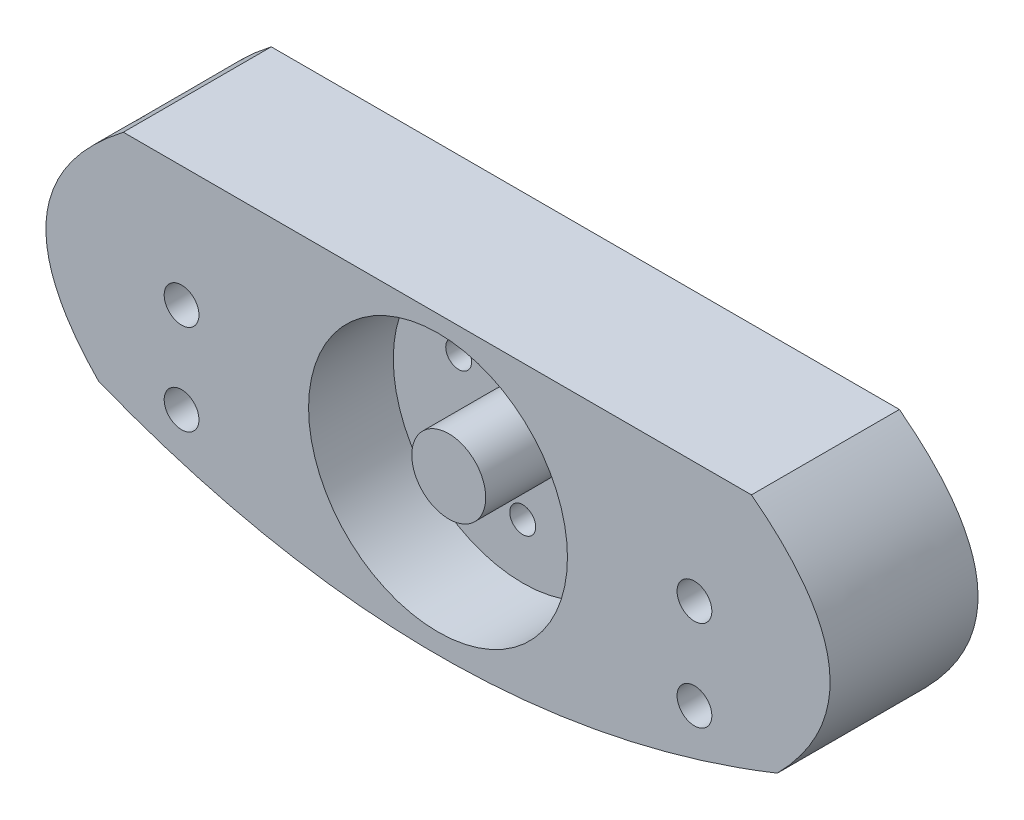
from build123d import *

# Parameters (mm, degrees)
BOSS_EXTRUDE1_DEPTH                              = 20
SKETCH4_R                                        = 17.5
CUT_EXTRUDE1_DEPTH                               = 11.453250926
SKETCH5_R                                        = 5
BOSS_EXTRUDE2_DEPTH                              = 10
CBORE_FOR_M5_HEX_HEAD_MACHINE_SCREW2_D           = 3.5
CBORE_FOR_M5_HEX_HEAD_MACHINE_SCREW2_DEPTH       = 11
CBORE_FOR_M5_HEX_HEAD_MACHINE_SCREW2_CBORE_D     = 7
CBORE_FOR_M5_HEX_HEAD_MACHINE_SCREW2_CBORE_DEPTH = 4
CBORE_FOR_M5_HEX_HEAD_MACHINE_SCREW2_TIP         = 1.75
CUT_EXTRUDE2_DEPTH                               = 65.71473925
CUT_EXTRUDE2_DEPTH_BACK                          = 65.71473925
SKETCH11_R                                       = 2.35


with BuildPart() as part:
    # Sketch2 → Boss-Extrude1 (new body)
    with BuildSketch(Plane.XY):
        with BuildLine():
            Line((42.376776125, 8.683218748), (-42.540089832, 8.683218747))
            add(Edge.make_bspline(
                [(-42.540089832, 8.683218747), (-61.647606257, -6.072667773), (-45.873698376, -22.15549797)],
                knots=[0, 0, 0, 1, 1, 1], degree=2))
            add(Edge.make_bspline(
                [(-45.873698376, -22.15549797), (0.203235462, -40.398996626), (45.873698397, -22.155497949)],
                knots=[0, 0, 0, 1, 1, 1], degree=2))
            add(Edge.make_bspline(
                [(45.873698397, -22.155497949), (61.713202875, -6.005950809), (42.376776125, 8.683218748)],
                knots=[0, 0, 0, 1, 1, 1], degree=2))
        make_face()
    extrude(amount=BOSS_EXTRUDE1_DEPTH)

    # Sketch4 → Cut-Extrude1 (cut)
    with BuildSketch(Plane.XY.offset(20)):
        with Locations((0, -11.063024907)):
            Circle(SKETCH4_R)
    extrude(amount=-CUT_EXTRUDE1_DEPTH, mode=Mode.SUBTRACT)

    # Sketch5 → Boss-Extrude2 (add)
    with BuildSketch(Plane.XY.offset(8.546749074)):
        with Locations((0, -11.063024907)):
            Circle(SKETCH5_R)
    extrude(amount=BOSS_EXTRUDE2_DEPTH)

    # CBORE for M5 Hex Head Machine Screw2
    with Locations(Plane(origin=(0, 0, 0), x_dir=(-1, 0, 0), z_dir=(0, 0, -1))):
        with Locations((-8.660254038, -6.129479586), (0, -21.129479586), (8.660254038, -6.129479586)):
            CounterBoreHole(CBORE_FOR_M5_HEX_HEAD_MACHINE_SCREW2_D / 2, CBORE_FOR_M5_HEX_HEAD_MACHINE_SCREW2_CBORE_D / 2, CBORE_FOR_M5_HEX_HEAD_MACHINE_SCREW2_CBORE_DEPTH, depth=CBORE_FOR_M5_HEX_HEAD_MACHINE_SCREW2_DEPTH)
            with Locations((0, 0, -(CBORE_FOR_M5_HEX_HEAD_MACHINE_SCREW2_DEPTH + CBORE_FOR_M5_HEX_HEAD_MACHINE_SCREW2_TIP / 2))):  # 90° drill point
                Cone(0, CBORE_FOR_M5_HEX_HEAD_MACHINE_SCREW2_D / 2, CBORE_FOR_M5_HEX_HEAD_MACHINE_SCREW2_TIP, mode=Mode.SUBTRACT)

    # Sketch11 → Cut-Extrude2 (cut, two sides: drawn at the far end of the back side and taken through both)
    with BuildSketch(Plane.XY.offset(20).offset(-CUT_EXTRUDE2_DEPTH_BACK)):
        with Locations((-34.669778537, -19.865188652)):
            Circle(SKETCH11_R)
        with Locations((-34.669778537, -7.616948648)):
            Circle(SKETCH11_R)
        with Locations((34.669778537, -7.616948648)):
            Circle(SKETCH11_R)
        with Locations((34.669778537, -19.865188652)):
            Circle(SKETCH11_R)
    extrude(amount=CUT_EXTRUDE2_DEPTH + CUT_EXTRUDE2_DEPTH_BACK, mode=Mode.SUBTRACT)


solid = part.part
